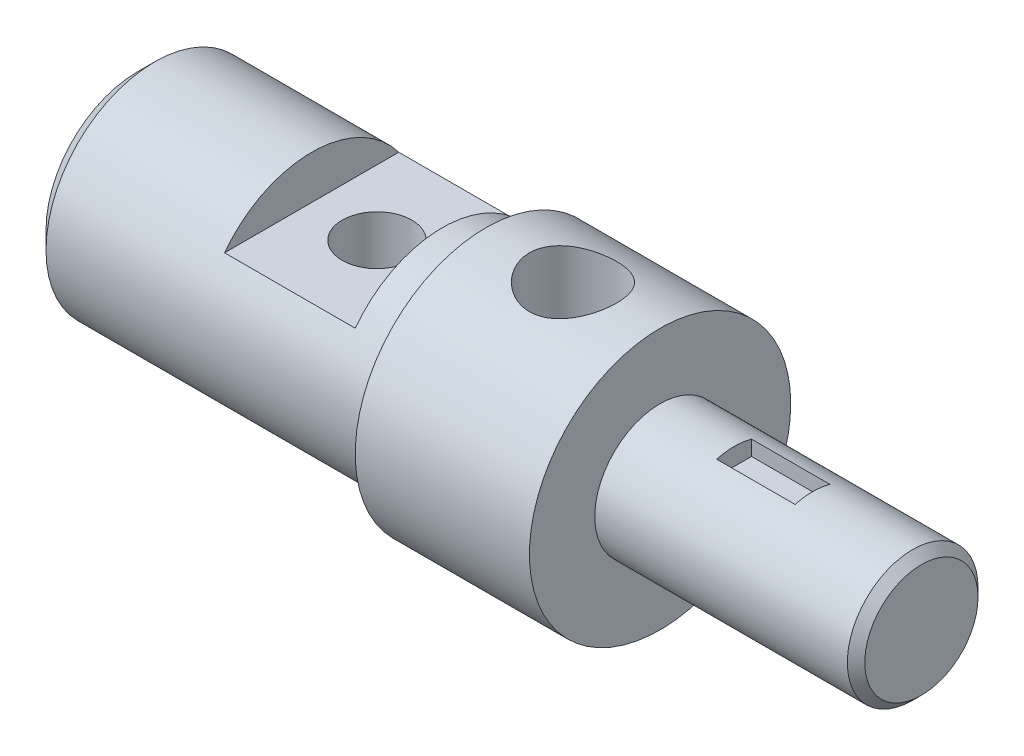
from build123d import *

# Parameters (mm, degrees)
CUT_EXTRUDE_7_DEPTH         = 185.932420089
CUT_EXTRUDE_7_DEPTH_BACK    = 185.932420089
SKETCH_10_W                 = 30
SKETCH_10_H                 = 10
SKETCH_14_R                 = 8
CUT_EXTRUDE_8_DEPTH         = 188.949461292
SKETCH_6_W                  = 18
SKETCH_6_H                  = 4
CUT_EXTRUDE_4_DEPTH         = 4
HOLE_WIZARD_20_0_20_1_D     = 20
HOLE_WIZARD_20_0_20_1_DEPTH = 35
HOLE_WIZARD_20_0_20_1_TIP   = 6.00860619
CHAMFER_3_SIZE              = 2
CHAMFER_4_SIZE              = 4


with BuildPart() as part:
    # Эскиз1 → Повернуть1 (revolve)
    with BuildSketch(Plane.XY, mode=Mode.PRIVATE) as revolve_1_sk:
        Polygon((0, 0), (0, 25), (80, 25), (80, 30), (120, 30), (120, 15), (180, 15), (180, 0), align=None)
    revolve(revolve_1_sk.sketch.rotate(Axis((0, 0, 0), (-1, 0, 0)), 90), axis=Axis((0, 0, 0), (-1, 0, 0)))

    # Эскиз10 → Вырез-Вытянуть7 (cut, two sides: drawn at the far end of the back side and taken through both)
    with BuildSketch(Plane.XY.offset(-CUT_EXTRUDE_7_DEPTH_BACK)):
        with Locations((55, 20)):
            Rectangle(SKETCH_10_W, SKETCH_10_H)
    extrude(amount=CUT_EXTRUDE_7_DEPTH + CUT_EXTRUDE_7_DEPTH_BACK, mode=Mode.SUBTRACT)

    # Эскиз14 → Вырез-Вытянуть8 (cut, through all)
    with BuildSketch(Plane(origin=(0, 15, 0), x_dir=(1, 0, 0), z_dir=(0, 1, 0))):
        with Locations(Location((55, 0, 0), (0, 0, 270))):
            Circle(SKETCH_14_R)
    extrude(amount=-CUT_EXTRUDE_8_DEPTH, mode=Mode.SUBTRACT)

    # Эскиз6 → Вырез-Вытянуть4 (cut, symmetric)
    with BuildSketch(Plane.XY):
        with Locations((146, 13)):
            Rectangle(SKETCH_6_W, SKETCH_6_H)
    extrude(amount=CUT_EXTRUDE_4_DEPTH, both=True, mode=Mode.SUBTRACT)

    # Диаметр отверстия Ø20.0 (20)1
    with Locations(Plane(origin=(0, 30, 0), x_dir=(1, 0, 0), z_dir=(0, 1, 0))):
        with Locations((100, 0)):
            Hole(HOLE_WIZARD_20_0_20_1_D / 2, depth=HOLE_WIZARD_20_0_20_1_DEPTH)
            with Locations((0, 0, -(HOLE_WIZARD_20_0_20_1_DEPTH + HOLE_WIZARD_20_0_20_1_TIP / 2))):  # 118° drill point
                Cone(0, HOLE_WIZARD_20_0_20_1_D / 2, HOLE_WIZARD_20_0_20_1_TIP, mode=Mode.SUBTRACT)

    # Фаска3
    chamfer_3_edges = [part.edges().sort_by_distance(p)[0] for p in [
        (180, 0, 15),
    ]]
    chamfer(chamfer_3_edges, length=CHAMFER_3_SIZE)

    # Фаска4
    chamfer_4_edges = [part.edges().sort_by_distance(p)[0] for p in [
        (0, 0, 25),
    ]]
    chamfer(chamfer_4_edges, length=CHAMFER_4_SIZE)


solid = part.part
